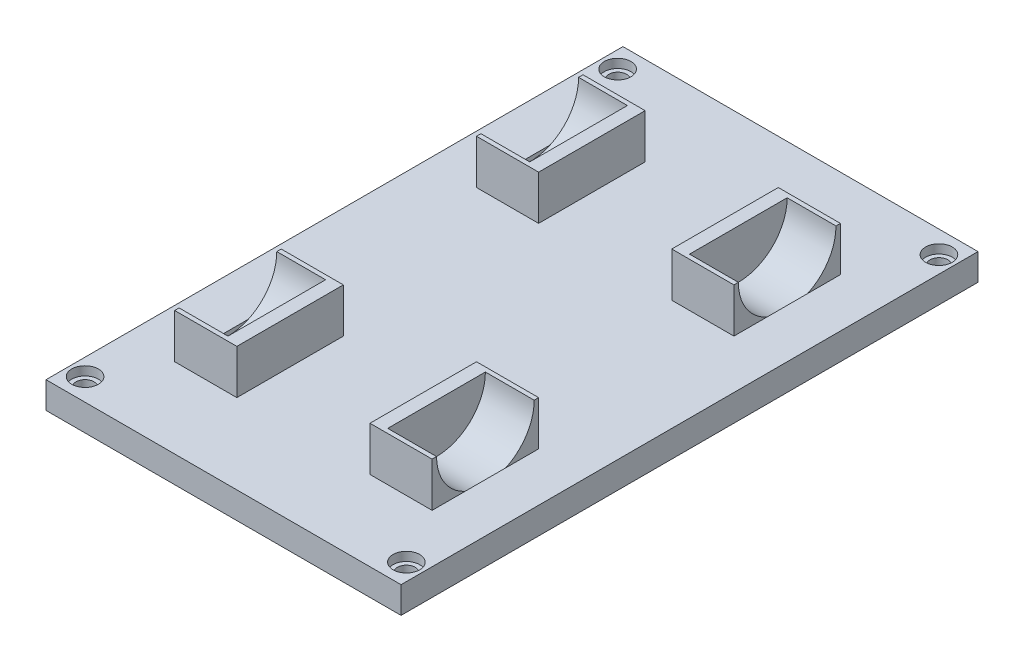
from build123d import *

# Parameters (mm, degrees)
SKETCH_4_W          = 40
SKETCH_4_H          = 65
EXTRUDE_1_DEPTH     = 3
SKETCH_5_R          = 5.05
CUT_EXTRUDE_1_DEPTH = 2
SKETCH_6_R          = 1.5
SKETCH_6_R_2        = 1
CUT_EXTRUDE_2_DEPTH = 1
SKETCH_6_2_R        = 1
CUT_EXTRUDE_3_DEPTH = 39.278584091
SKETCH_7_W          = 7
SKETCH_7_H          = 12
EXTRUDE_2_DEPTH     = 5
SKETCH_8_R          = 5.5
CUT_EXTRUDE_4_DEPTH = 5.5
CUT_EXTRUDE_START   = -23.5
SKETCH_8_2_R        = 5.5
CUT_EXTRUDE_5_DEPTH = 5.5


with BuildPart() as part:
    # 草图4 → 凸台-拉伸1 (new body)
    with BuildSketch(Plane(origin=(0, 0, 0), x_dir=(1, 0, 0), z_dir=(0, 1, 0))):
        Rectangle(SKETCH_4_W, SKETCH_4_H)
    extrude(amount=EXTRUDE_1_DEPTH)

    # 草图5 → 切除-拉伸1 (cut)
    with BuildSketch(Plane.XZ):
        with Locations(Location((-12, 22.5, 0), (0, 0, 270))):
            Circle(SKETCH_5_R)
        with Locations(Location((12, 22.5, 0), (0, 0, 270))):
            Circle(SKETCH_5_R)
        with Locations(Location((12, -22.5, 0), (0, 0, 270))):
            Circle(SKETCH_5_R)
        with Locations(Location((-12, -22.5, 0), (0, 0, 270))):
            Circle(SKETCH_5_R)
    extrude(amount=-CUT_EXTRUDE_1_DEPTH, mode=Mode.SUBTRACT)

    # 草图6 → 切除-拉伸2 (cut)
    # profile 1 of 4: a face of its own
    with BuildSketch(Plane(origin=(0, 3, 0), x_dir=(1, 0, 0), z_dir=(0, 1, 0))):
        with Locations(Location((-18.1, 30, 0), (0, 0, 270))):
            Circle(SKETCH_6_R)
        with Locations(Location((-18.1, 30, 0), (0, 0, 270))):
            Circle(SKETCH_6_R_2, mode=Mode.SUBTRACT)
    # profile 2 of 4: a face of its own
    with BuildSketch(Plane(origin=(0, 3, 0), x_dir=(1, 0, 0), z_dir=(0, 1, 0))):
        with Locations(Location((18.1, 30, 0), (0, 0, 270))):
            Circle(SKETCH_6_R)
        with Locations(Location((18.1, 30, 0), (0, 0, 270))):
            Circle(SKETCH_6_R_2, mode=Mode.SUBTRACT)
    # profile 3 of 4: a face of its own
    with BuildSketch(Plane(origin=(0, 3, 0), x_dir=(1, 0, 0), z_dir=(0, 1, 0))):
        with Locations(Location((-18.1, -30, 0), (0, 0, 270))):
            Circle(SKETCH_6_R)
        with Locations(Location((-18.1, -30, 0), (0, 0, 270))):
            Circle(SKETCH_6_R_2, mode=Mode.SUBTRACT)
    # profile 4 of 4: a face of its own
    with BuildSketch(Plane(origin=(0, 3, 0), x_dir=(1, 0, 0), z_dir=(0, 1, 0))):
        with Locations(Location((18.1, -30, 0), (0, 0, 270))):
            Circle(SKETCH_6_R)
        with Locations(Location((18.1, -30, 0), (0, 0, 270))):
            Circle(SKETCH_6_R_2, mode=Mode.SUBTRACT)
    extrude(amount=-CUT_EXTRUDE_2_DEPTH, mode=Mode.SUBTRACT)

    # 草图6<2> → 切除-拉伸3 (cut, through all)
    with BuildSketch(Plane(origin=(0, 3, 0), x_dir=(1, 0, 0), z_dir=(0, 1, 0))):
        with Locations(Location((-18.1, -30, 0), (0, 0, 270))):
            Circle(SKETCH_6_2_R)
        with Locations(Location((18.1, -30, 0), (0, 0, 270))):
            Circle(SKETCH_6_2_R)
        with Locations(Location((18.1, 30, 0), (0, 0, 270))):
            Circle(SKETCH_6_2_R)
        with Locations(Location((-18.1, 30, 0), (0, 0, 270))):
            Circle(SKETCH_6_2_R)
    extrude(amount=-CUT_EXTRUDE_3_DEPTH, mode=Mode.SUBTRACT)

    # 草图7 → 凸台-拉伸2 (add)
    with BuildSketch(Plane(origin=(0, 3, 0), x_dir=(1, 0, 0), z_dir=(0, 1, 0))):
        with Locations((-11, 16.5)):
            Rectangle(SKETCH_7_W, SKETCH_7_H)
        with Locations((11, 16.5)):
            Rectangle(SKETCH_7_W, SKETCH_7_H)
        with Locations((11, -17.5)):
            Rectangle(SKETCH_7_W, SKETCH_7_H)
        with Locations((-11, -17.5)):
            Rectangle(SKETCH_7_W, SKETCH_7_H)
    extrude(amount=EXTRUDE_2_DEPTH)

    # 草图8 → 切除-拉伸4 (cut)
    with BuildSketch(Plane.ZY.offset(14.5)):
        with Locations((-16.5, 8)):
            Circle(SKETCH_8_R)
        with Locations((17.5, 8)):
            Circle(SKETCH_8_R)
    extrude(amount=-CUT_EXTRUDE_4_DEPTH, mode=Mode.SUBTRACT)

    # 草图8<2> → 切除-拉伸5 (cut)
    with BuildSketch(Plane.ZY.offset(14.5).offset(CUT_EXTRUDE_START)):
        with Locations((-16.5, 8)):
            Circle(SKETCH_8_2_R)
        with Locations((17.5, 8)):
            Circle(SKETCH_8_2_R)
    extrude(amount=-CUT_EXTRUDE_5_DEPTH, mode=Mode.SUBTRACT)


solid = part.part
